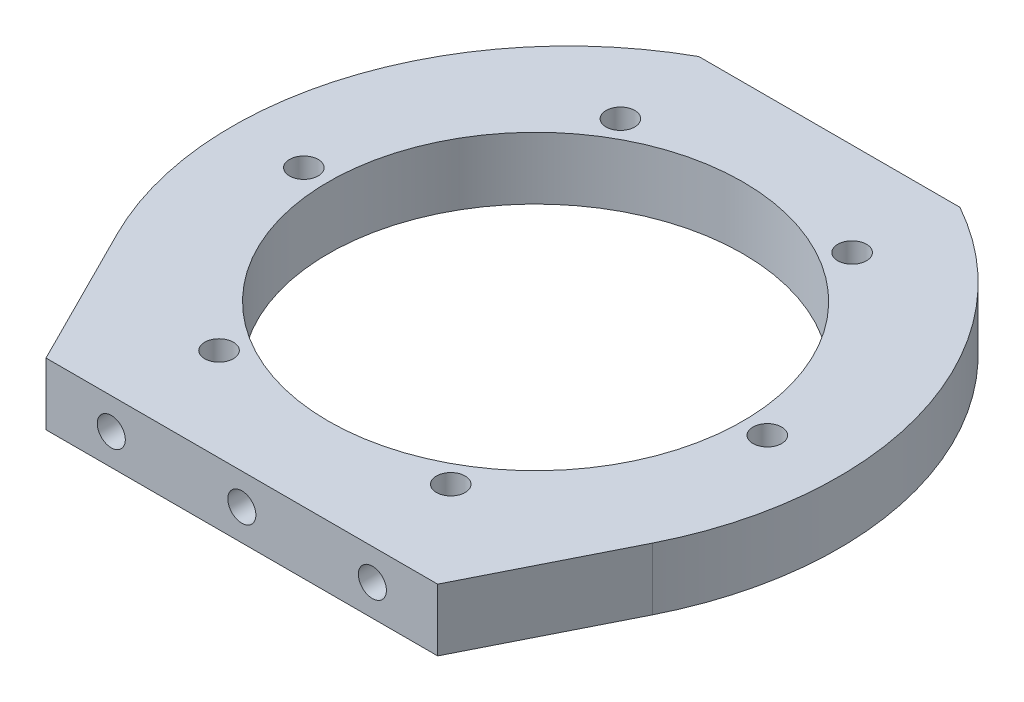
from build123d import *

# Parameters (mm, degrees)
F_3_8INCH_DEPTH    = 4.7625
SKETCH2_R          = 31.75
CUT_EXTRUDE1_DEPTH = 9.525
SKETCH3_R          = 2.2
M4_THROUGH_DEPTH   = 9.525
SKETCH4_R          = 2.15
M5X8_DRILL_DEPTH   = 8
SKETCH5_R          = 2.15
M5X8_DRILL2_DEPTH  = 8


with BuildPart() as part:
    # Sketch1 → 3/8inch (new, symmetric)
    with BuildSketch(Plane(origin=(0, 0, 0), x_dir=(1, 0, 0), z_dir=(0, 1, 0))):
        with BuildLine():
            Line((-30, -45), (30, -45))
            Line((30, -45), (40.997797218, -23.112824386))
            ThreePointArc((40.997797218, -23.112824386), (44.19360745, 15.165387766), (20, 45))
            Line((20, 45), (-20, 45))
            ThreePointArc((-20, 45), (-44.19360745, 15.165387766), (-40.997797218, -23.112824386))
            Line((-40.997797218, -23.112824386), (-30, -45))
        make_face()
    extrude(amount=F_3_8INCH_DEPTH, both=True)

    # Sketch2 → Cut-Extrude1 (cut)
    with BuildSketch(Plane(origin=(0, 4.7625, 0), x_dir=(1, 0, 0), z_dir=(0, 1, 0))):
        with Locations(Location((0, 0, 0), (0, 0, 270))):
            Circle(SKETCH2_R)
    extrude(amount=-CUT_EXTRUDE1_DEPTH, mode=Mode.SUBTRACT)

    # Sketch3 → M4_through (cut)
    with BuildSketch(Plane(origin=(0, 4.7625, 0), x_dir=(1, 0, 0), z_dir=(0, 1, 0))):
        with Locations(Location((17.75, 30.743901834, 0), (0, 0, 270))):
            Circle(SKETCH3_R)
        with Locations(Location((35.5, 0, 0), (0, 0, 270))):
            Circle(SKETCH3_R)
        with Locations(Location((17.75, -30.743901834, 0), (0, 0, 270))):
            Circle(SKETCH3_R)
        with Locations(Location((-17.75, -30.743901834, 0), (0, 0, 270))):
            Circle(SKETCH3_R)
        with Locations(Location((-35.5, 0, 0), (0, 0, 270))):
            Circle(SKETCH3_R)
        with Locations(Location((-17.75, 30.743901834, 0), (0, 0, 270))):
            Circle(SKETCH3_R)
    extrude(amount=-M4_THROUGH_DEPTH, mode=Mode.SUBTRACT)

    # Sketch4 → M5x8_DRILL (cut)
    with BuildSketch(Plane(origin=(0, 0, -45), x_dir=(-1, 0, 0), z_dir=(0, 0, -1))):
        with Locations((-12, 0)):
            Circle(SKETCH4_R)
        with Locations(Location((12, 0, 0), (0, 0, 180))):
            Circle(SKETCH4_R)
    extrude(amount=-M5X8_DRILL_DEPTH, mode=Mode.SUBTRACT)

    # Sketch5 → M5x8_DRILL2 (cut)
    with BuildSketch(Plane.XY.offset(45)):
        with Locations((-20, 0)):
            Circle(SKETCH5_R)
        with Locations(Location((20, 0, 0), (0, 0, 180))):
            Circle(SKETCH5_R)
        Circle(SKETCH5_R)
    extrude(amount=-M5X8_DRILL2_DEPTH, mode=Mode.SUBTRACT)


solid = part.part
